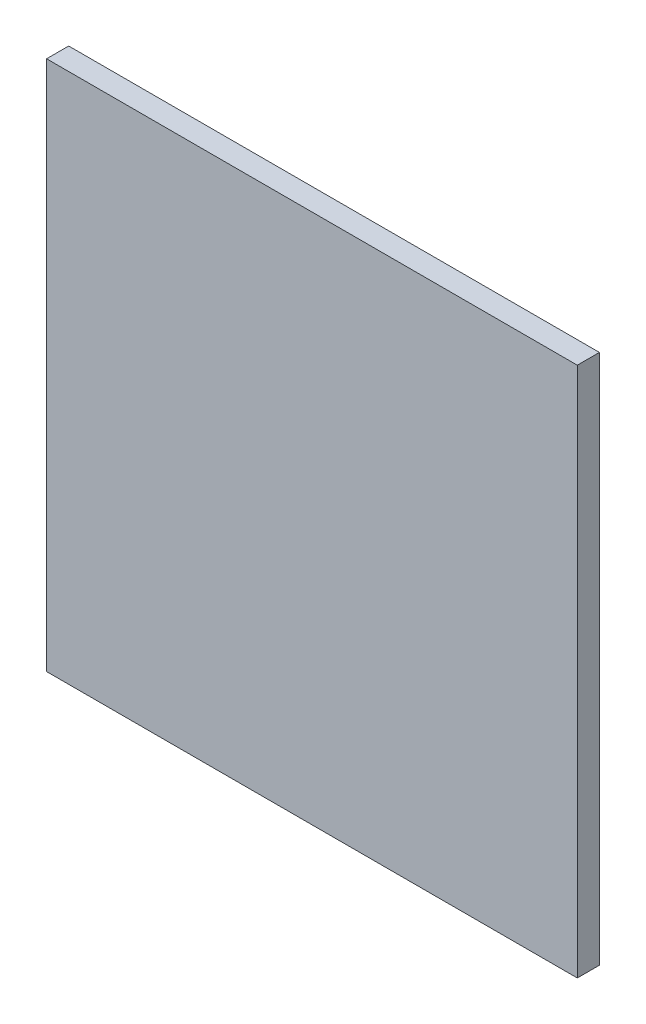
from build123d import *

# Parameters (mm, degrees)
SKETCH1_W           = 3048
SKETCH1_H           = 3048
BOSS_EXTRUDE1_DEPTH = 127


with BuildPart() as part:
    # Sketch1 → Boss-Extrude1 (new body)
    with BuildSketch(Plane.XY):
        with Locations((1524, 1524)):
            Rectangle(SKETCH1_W, SKETCH1_H)
    extrude(amount=BOSS_EXTRUDE1_DEPTH)


solid = part.part
